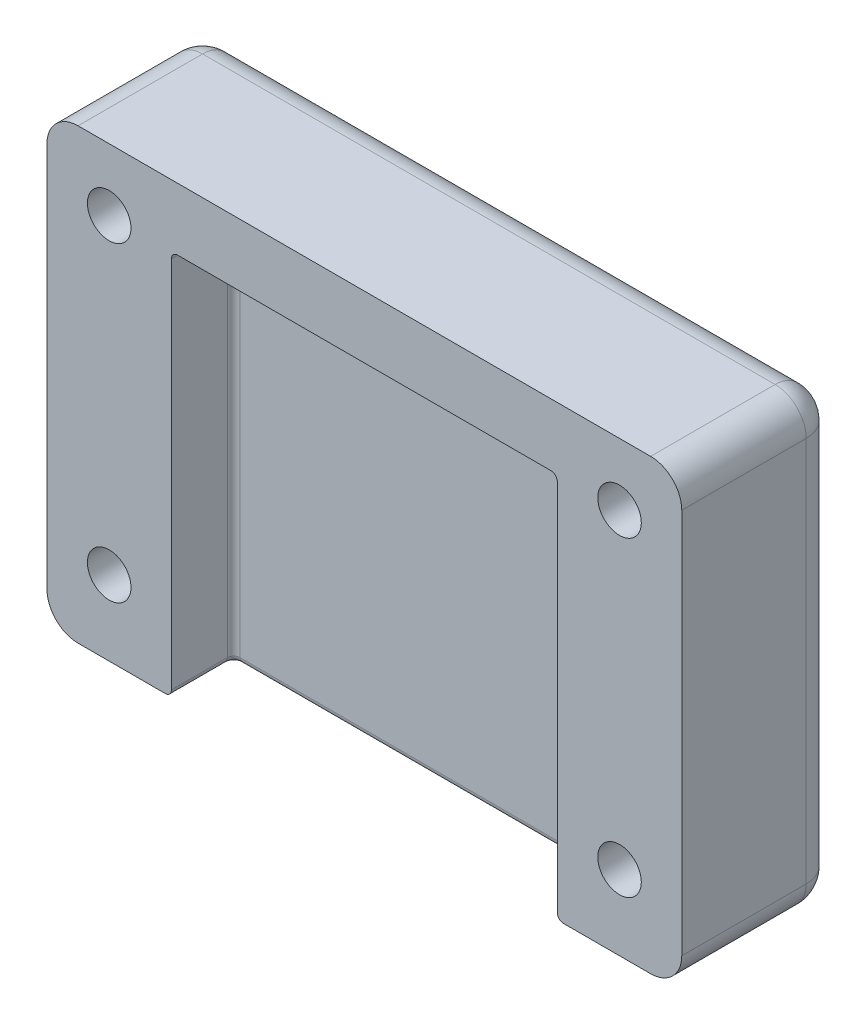
from build123d import *

# Parameters (mm, degrees)
SKETCH1_W           = 51
SKETCH1_H           = 36
BOSS_EXTRUDE1_DEPTH = 12.5
SKETCH2_W           = 31
SKETCH2_H           = 31
CUT_EXTRUDE1_DEPTH  = 5
SKETCH3_R           = 1.75
CUT_EXTRUDE2_DEPTH  = 64.665139598
FILLET1_R           = 0.5
FILLET2_R           = 2.5


with BuildPart() as part:
    # Sketch1 → Boss-Extrude1 (new body)
    with BuildSketch(Plane.XY):
        with Locations((25.5, 18)):
            Rectangle(SKETCH1_W, SKETCH1_H)
    extrude(amount=BOSS_EXTRUDE1_DEPTH)

    # Sketch2 → Cut-Extrude1 (cut)
    with BuildSketch(Plane.XY.offset(12.5)):
        with Locations((25.5, 15.5)):
            Rectangle(SKETCH2_W, SKETCH2_H)
    extrude(amount=-CUT_EXTRUDE1_DEPTH, mode=Mode.SUBTRACT)

    # Sketch3 → Cut-Extrude2 (cut, through all)
    with BuildSketch(Plane.XY.offset(12.5)):
        with Locations((5, 31)):
            Circle(SKETCH3_R)
        with Locations((5, 6)):
            Circle(SKETCH3_R)
        with Locations((46, 31)):
            Circle(SKETCH3_R)
        with Locations((46, 6)):
            Circle(SKETCH3_R)
    extrude(amount=-CUT_EXTRUDE2_DEPTH, mode=Mode.SUBTRACT)

    # Fillet1
    fillet1_edges = [part.edges().sort_by_distance(p)[0] for p in [
        (25.5, 0, 7.5),
        (41, 0, 10),
        (10, 15.5, 7.5),
        (10, 0, 10),
        (25.5, 31, 7.5),
        (10, 31, 10),
        (41, 15.5, 7.5),
        (41, 31, 10),
    ]]
    fillet(fillet1_edges, radius=FILLET1_R)

    # Fillet2
    fillet2_edges = [part.edges().sort_by_distance(p)[0] for p in [
        (25.5, 36, 0),
        (51, 18, 0),
        (25.5, 0, 0),
        (0, 18, 0),
        (0, 36, 6.25),
        (51, 36, 6.25),
        (51, 0, 6.25),
        (0, 0, 6.25),
    ]]
    fillet(fillet2_edges, radius=FILLET2_R)


solid = part.part
